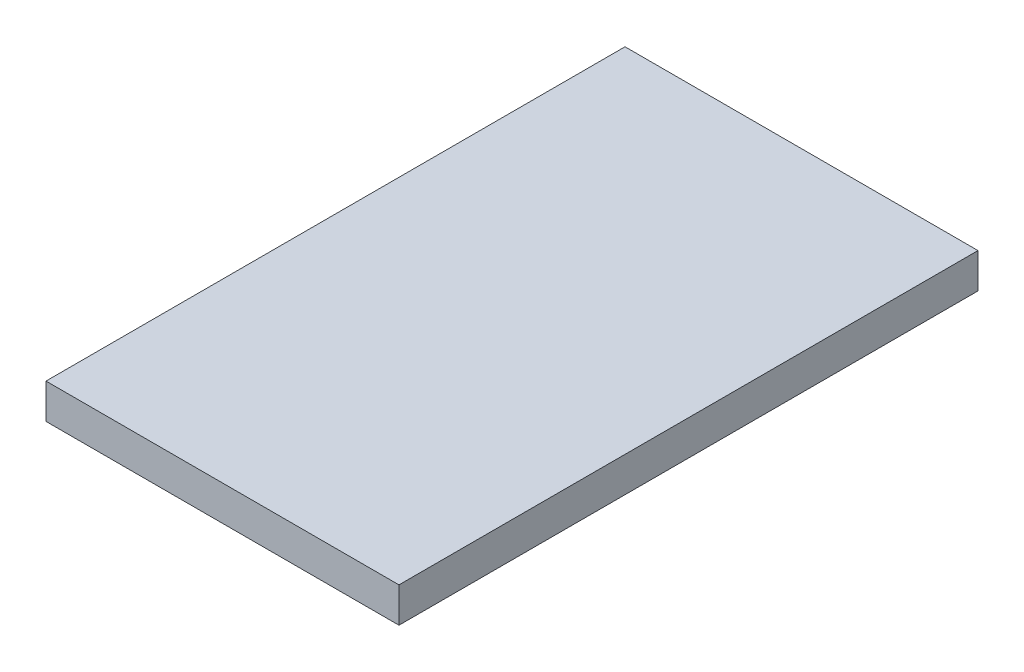
from build123d import *

# Parameters (mm, degrees)
SKETCH1_W           = 120
SKETCH1_H           = 196.85
BOSS_EXTRUDE1_DEPTH = 11.8872


with BuildPart() as part:
    # Sketch1 → Boss-Extrude1 (new body)
    with BuildSketch(Plane(origin=(0, 0, 0), x_dir=(1, 0, 0), z_dir=(0, 1, 0))):
        with Locations((60, 98.425)):
            Rectangle(SKETCH1_W, SKETCH1_H)
    extrude(amount=BOSS_EXTRUDE1_DEPTH)


solid = part.part
